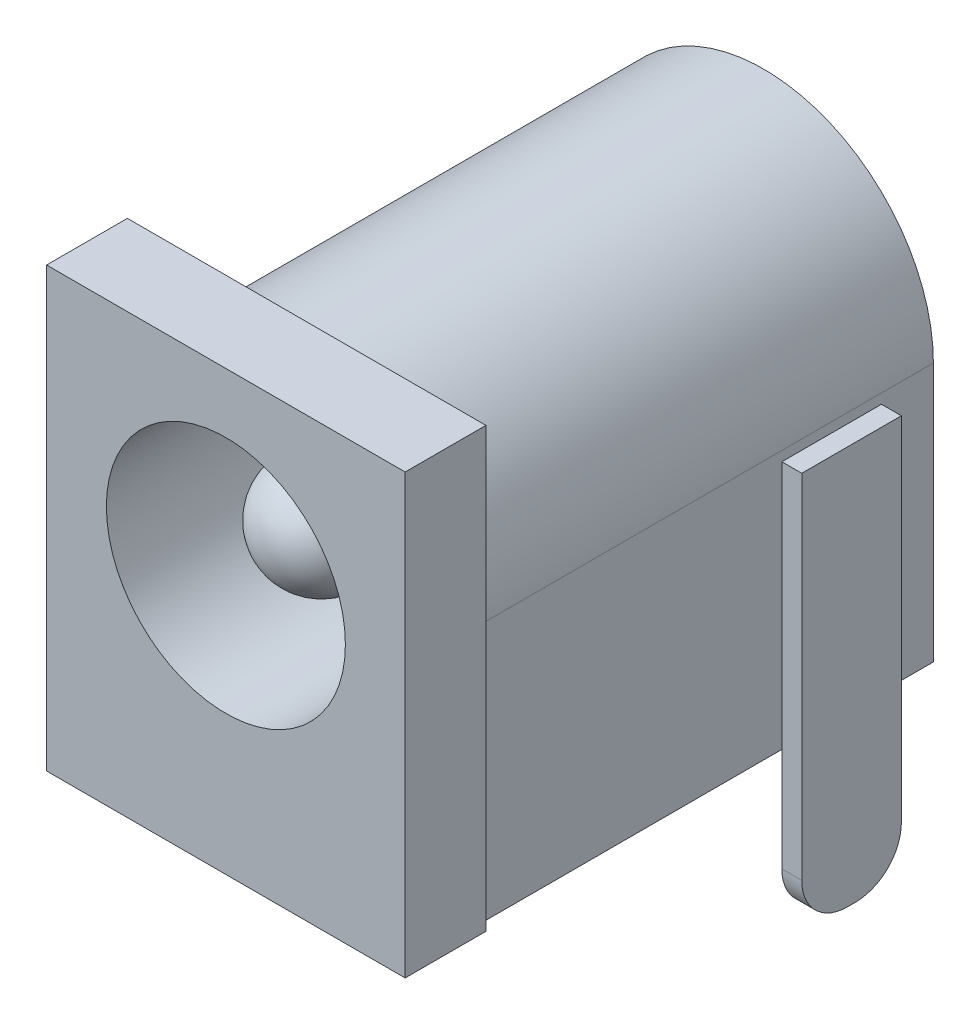
from build123d import *

# Parameters (mm, degrees)
SKETCH1_W           = 9
SKETCH1_H           = 11
EXTRUDE1_DEPTH      = 13.5
CUT_EXTRUDE1_DEPTH  = 11.472184734
EXTRUDE2_DEPTH      = 3.5
EXTRUDE2_DEPTH_BACK = 6.5
SKETCH3_W           = 2.5
SKETCH3_H           = 0.5
SKETCH3_W_2         = 0.5
SKETCH3_H_2         = 2.5
CUT_EXTRUDE2_DEPTH  = 0.5
CUT_EXTRUDE3_REACH  = 22.063
SKETCH6_R           = 3
CUT_EXTRUDE4_DEPTH  = 10.5
SKETCH7_R           = 1.341174798
EXTRUDE3_DEPTH      = 8.5
DOME1_FACE_RADIUS   = 1.341174798
DOME1_HEIGHT        = 1


with BuildPart() as part:
    # Sketch1 → Extrude1 (new body)
    with BuildSketch(Plane.XY):
        with Locations((4.5, 5.5)):
            Rectangle(SKETCH1_W, SKETCH1_H)
    extrude(amount=EXTRUDE1_DEPTH)

    # Sketch2 → Cut-Extrude1 (cut)
    with BuildSketch(Plane(origin=(0, 0, 0), x_dir=(-1, 0, 0), z_dir=(0, 0, -1))):
        with BuildLine():
            Line((-8.759861733, 6.5), (-8.759861733, 0))
            Line((-8.759861733, 0), (-10.235511259, 0))
            Line((-10.235511259, 0), (-10.235511259, 11.286267996))
            Line((-10.235511259, 11.286267996), (1.276116648, 11.286267996))
            Line((1.276116648, 11.286267996), (1.276116648, 0))
            Line((1.276116648, 0), (-0.240138267, 0))
            Line((-0.240138267, 0), (-0.240138267, 6.5))
            ThreePointArc((-0.240138267, 6.5), (-4.5, 10.759861733), (-8.759861733, 6.5))
        make_face()
    extrude(amount=-CUT_EXTRUDE1_DEPTH, mode=Mode.SUBTRACT)

    # Sketch3 → Extrude2 (add, two sides: drawn at the far end of the back side and taken through both)
    with BuildSketch(Plane.XZ.offset(-EXTRUDE2_DEPTH_BACK)):
        with Locations((4.5, 5.8)):
            Rectangle(SKETCH3_W, SKETCH3_H)
        with Locations((9.255436424, 2.8)):
            Rectangle(SKETCH3_W_2, SKETCH3_H_2)
        with Locations((4.5, -0.076449713)):
            Rectangle(SKETCH3_W, SKETCH3_H)
    extrude(amount=EXTRUDE2_DEPTH + EXTRUDE2_DEPTH_BACK)


with BuildPart() as extrude2_piece_1:
    # of the separate pieces the step leaves, piece 1, a body of its own (extrude2_pieces)
    add(part.part.solids().sort_by_distance((0, 0, 11.472184734))[0])

    # Cut-Extrude3: up to this face of the body (flat: up to its plane)
    cut_extrude3_end = Plane(extrude2_piece_1.part.faces().sort_by_distance((4.5, -1.75, 6.05))[0])
    # Sketch5 → Cut-Extrude3 (cut, up to the picked face)
    with BuildSketch(Plane(origin=(0, 0, -0.326449713), x_dir=(-1, 0, 0), z_dir=(0, 0, -1)), mode=Mode.PRIVATE) as cut_extrude3_sk1:
        with BuildLine():
            Line((-3.25, -0.558332619), (-2.247520265, -0.558332619))
            Line((-2.247520265, -0.558332619), (-2.247520265, -4.051690435))
            Line((-2.247520265, -4.051690435), (-6.966055813, -4.051690435))
            Line((-6.966055813, -4.051690435), (-6.966055813, -0.558332619))
            Line((-6.966055813, -0.558332619), (-5.75, -0.558332619))
            Line((-5.75, -0.558332619), (-5.75, -2.35))
            ThreePointArc((-5.75, -2.35), (-5.413172798, -3.163172798), (-4.6, -3.5))
            Line((-4.6, -3.5), (-4.4, -3.5))
            ThreePointArc((-4.4, -3.5), (-3.586827202, -3.163172798), (-3.25, -2.35))
            Line((-3.25, -2.35), (-3.25, -0.558332619))
        make_face()
    cut_extrude3_tool1 = split(extrude(cut_extrude3_sk1.sketch, amount=-CUT_EXTRUDE3_REACH, mode=Mode.PRIVATE), bisect_by=cut_extrude3_end, keep=Keep.BOTH, mode=Mode.PRIVATE)
    add(cut_extrude3_tool1.solids().sort_by(Axis((3.19129, -1.454166, -0.32645), (0, 0, 1)))[0], mode=Mode.SUBTRACT)

    # Sketch6 → Cut-Extrude4 (cut)
    with BuildSketch(Plane.XY.offset(13.5)):
        with Locations((4.5, 6.5)):
            Circle(SKETCH6_R)
    extrude(amount=-CUT_EXTRUDE4_DEPTH, mode=Mode.SUBTRACT)

    # Sketch7 → Extrude3 (add)
    with BuildSketch(Plane.XY.offset(3)):
        with Locations((4.5, 6.5)):
            Circle(SKETCH7_R)
    extrude(amount=EXTRUDE3_DEPTH)

    # Dome1: a dome of height H over a round flat face of radius A is a cap of a sphere of radius (A * A + H * H) / (2 * H)
    dome1_r = (DOME1_FACE_RADIUS * DOME1_FACE_RADIUS + DOME1_HEIGHT * DOME1_HEIGHT) / (2 * DOME1_HEIGHT)
    dome1_base = Plane((4.5, 6.5, 11.5), z_dir=(0, 0, 1))
    with Locations(dome1_base.offset(DOME1_HEIGHT - dome1_r)):
        dome1_ball = Sphere(dome1_r, mode=Mode.PRIVATE)
    add(split(dome1_ball, bisect_by=dome1_base, keep=Keep.TOP, mode=Mode.PRIVATE))


with BuildPart() as extrude2_piece_2:
    # of the separate pieces the step leaves, piece 2, a body of its own (extrude2_pieces)
    add(part.part.solids().sort_by_distance((9.505436424, -3.5, 4.05))[0])

    # Sketch4 → Cut-Extrude2 (cut)
    with BuildSketch(Plane(origin=(9.505436424, 0, 0), x_dir=(0, 0, -1), z_dir=(1, 0, 0))):
        with BuildLine():
            Line((-1.55, 0.401221022), (-0.317888933, 0.401221022))
            Line((-0.317888933, 0.401221022), (-0.317888933, -4.045287891))
            Line((-0.317888933, -4.045287891), (-5.095635432, -4.045287891))
            Line((-5.095635432, -4.045287891), (-5.095635432, 0.401221022))
            Line((-5.095635432, 0.401221022), (-4.05, 0.401221022))
            Line((-4.05, 0.401221022), (-4.05, -2.35))
            ThreePointArc((-4.05, -2.35), (-3.713172798, -3.163172798), (-2.9, -3.5))
            Line((-2.9, -3.5), (-2.7, -3.5))
            ThreePointArc((-2.7, -3.5), (-1.886827202, -3.163172798), (-1.55, -2.35))
            Line((-1.55, -2.35), (-1.55, 0.401221022))
        make_face()
    extrude(amount=-CUT_EXTRUDE2_DEPTH, mode=Mode.SUBTRACT)


solid = Compound([extrude2_piece_1.part, extrude2_piece_2.part])
